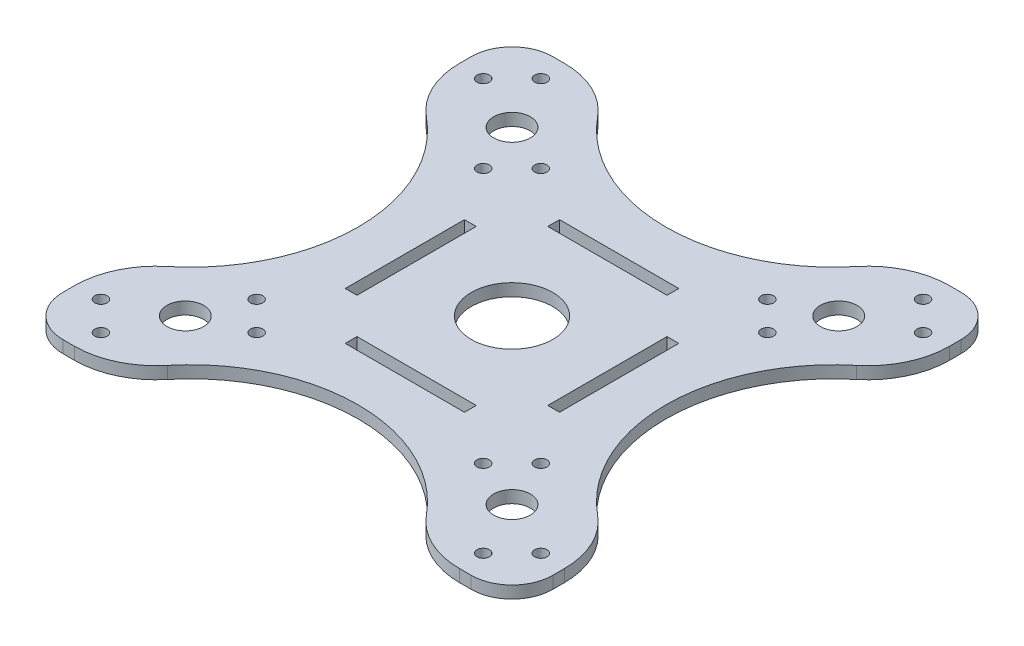
from build123d import *

# Parameters (mm, degrees)
EXTRUDE_1_DEPTH          = 3
FILLET_1_R               = 10
FILLET_2_R               = 10
FILLET_3_R               = 10
FILLET_4_R               = 10
SKETCH_2_R               = 1.52
SKETCH_2_R_2             = 4.5
SKETCH_2_W               = 29.255357074
SKETCH_2_H               = 2.887641603
CUT_EXTRUDE_1_DEPTH      = 49
FILLET_5_R               = 20
FILLET_6_R               = 20
PATTERN_CIRCULAR_2_COUNT = 4
SKETCH_3_R               = 10
CUT_EXTRUDE_2_DEPTH      = 49
FILLET_7_R               = 20
FILLET_8_R               = 20
FILLET_9_R               = 20
FILLET_10_R              = 20
FILLET_11_R              = 20
FILLET_12_R              = 20


with BuildPart() as part:
    # 草图1 → 凸台-拉伸1 (new body)
    with BuildSketch(Plane(origin=(0, 0, 0), x_dir=(1, 0, 0), z_dir=(0, 1, 0))):
        with BuildLine():
            Line((60.104076401, -60.104076401), (36.583704196, -60.104076401))
            ThreePointArc((36.583704196, -60.104076401), (0, -37.75481759), (-36.583704196, -60.104076401))
            Line((-36.583704196, -60.104076401), (-60.104076401, -60.104076401))
            Line((-60.104076401, -60.104076401), (-60.104076401, -36.583704196))
            ThreePointArc((-60.104076401, -36.583704196), (-37.75481759, 0), (-60.104076401, 36.583704196))
            Line((-60.104076401, 36.583704196), (-60.104076401, 60.104076401))
            Line((-60.104076401, 60.104076401), (-36.583704196, 60.104076401))
            ThreePointArc((-36.583704196, 60.104076401), (0, 37.75481759), (36.583704196, 60.104076401))
            Line((36.583704196, 60.104076401), (60.104076401, 60.104076401))
            Line((60.104076401, 60.104076401), (60.104076401, 36.583704196))
            ThreePointArc((60.104076401, 36.583704196), (37.75481759, 0), (60.104076401, -36.583704196))
            Line((60.104076401, -36.583704196), (60.104076401, -60.104076401))
        make_face()
    extrude(amount=EXTRUDE_1_DEPTH)

    # 圆角1
    fillet_1_edges = [part.edges().sort_by_distance(p)[0] for p in [
        (60.104076401, 1.5, 60.104076401),
    ]]
    fillet(fillet_1_edges, radius=FILLET_1_R)

    # 圆角2
    fillet_2_edges = [part.edges().sort_by_distance(p)[0] for p in [
        (60.104076401, 1.5, -60.104076401),
    ]]
    fillet(fillet_2_edges, radius=FILLET_2_R)

    # 圆角3
    fillet_3_edges = [part.edges().sort_by_distance(p)[0] for p in [
        (-60.104076401, 1.5, -60.104076401),
    ]]
    fillet(fillet_3_edges, radius=FILLET_3_R)

    # 圆角4
    fillet_4_edges = [part.edges().sort_by_distance(p)[0] for p in [
        (-60.104076401, 1.5, 60.104076401),
    ]]
    fillet(fillet_4_edges, radius=FILLET_4_R)

    # 草图2 → 切除-拉伸1 (cut)
    with BuildSketch(Plane(origin=(0, 3, 0), x_dir=(1, 0, 0), z_dir=(0, 1, 0))):
        with Locations(Location((-27.792783788, 34.8638516, 0), (0, 0, 270))):
            Circle(SKETCH_2_R)
        with Locations(Location((-34.8638516, 27.792783788, 0), (0, 0, 270))):
            Circle(SKETCH_2_R)
        with Locations(Location((-40.073266213, 40.073266213, 0), (0, 0, 270))):
            Circle(SKETCH_2_R_2)
        with Locations(Location((-46.88466688, 53.955734692, 0), (0, 0, 270))):
            Circle(SKETCH_2_R)
        with Locations(Location((-53.955734692, 46.88466688, 0), (0, 0, 270))):
            Circle(SKETCH_2_R)
        with Locations((0, 24.84759336)):
            Rectangle(SKETCH_2_W, SKETCH_2_H)
    cut_extrude_1 = extrude(amount=-CUT_EXTRUDE_1_DEPTH, mode=Mode.SUBTRACT)

    # 圆角5
    fillet_5_edges = [part.edges().sort_by_distance(p)[0] for p in [
        (-36.583704196, 1.5, -60.104076401),
    ]]
    fillet(fillet_5_edges, radius=FILLET_5_R)

    # 圆角6
    fillet_6_edges = [part.edges().sort_by_distance(p)[0] for p in [
        (-60.104076401, 1.5, -36.583704196),
    ]]
    fillet(fillet_6_edges, radius=FILLET_6_R)

    # 阵列(圆周)2: 切除-拉伸1 ×4 about axis
    pattern_circular_2_axis = Axis((0, 0, 0), (0, 1, 0))
    for i in range(1, PATTERN_CIRCULAR_2_COUNT):
        add(cut_extrude_1.rotate(pattern_circular_2_axis, i * 360 / PATTERN_CIRCULAR_2_COUNT), mode=Mode.SUBTRACT)

    # 草图3 → 切除-拉伸2 (cut)
    with BuildSketch(Plane(origin=(0, 3, 0), x_dir=(1, 0, 0), z_dir=(0, 1, 0))):
        with Locations(Location((0, 0, 0), (0, 0, 270))):
            Circle(SKETCH_3_R)
    extrude(amount=-CUT_EXTRUDE_2_DEPTH, mode=Mode.SUBTRACT)

    # 圆角7
    fillet_7_edges = [part.edges().sort_by_distance(p)[0] for p in [
        (60.104076401, 1.5, 36.583704196),
    ]]
    fillet(fillet_7_edges, radius=FILLET_7_R)

    # 圆角8
    fillet_8_edges = [part.edges().sort_by_distance(p)[0] for p in [
        (36.583704196, 1.5, 60.104076401),
    ]]
    fillet(fillet_8_edges, radius=FILLET_8_R)

    # 圆角9
    fillet_9_edges = [part.edges().sort_by_distance(p)[0] for p in [
        (-60.104076401, 1.5, 36.583704196),
    ]]
    fillet(fillet_9_edges, radius=FILLET_9_R)

    # 圆角10
    fillet_10_edges = [part.edges().sort_by_distance(p)[0] for p in [
        (-36.583704196, 1.5, 60.104076401),
    ]]
    fillet(fillet_10_edges, radius=FILLET_10_R)

    # 圆角11
    fillet_11_edges = [part.edges().sort_by_distance(p)[0] for p in [
        (36.583704196, 1.5, -60.104076401),
    ]]
    fillet(fillet_11_edges, radius=FILLET_11_R)

    # 圆角12
    fillet_12_edges = [part.edges().sort_by_distance(p)[0] for p in [
        (60.104076401, 1.5, -36.583704196),
    ]]
    fillet(fillet_12_edges, radius=FILLET_12_R)


solid = part.part
